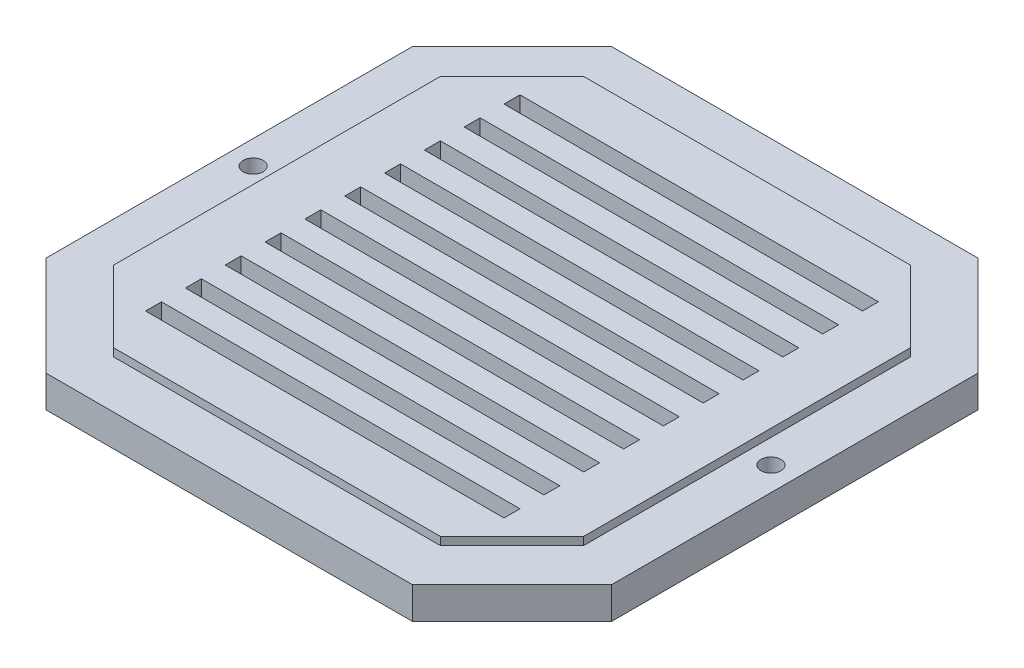
from build123d import *

# Parameters (mm, degrees)
BOSS_EXTRUDE1_DEPTH = 4
BOSS_EXTRUDE3_START = 4
BOSS_EXTRUDE3_DEPTH = 1
CUT_EXTRUDE2_REACH  = 52.364
SKETCH5_R           = 1.25
SKETCH6_R           = 2.25
CUT_EXTRUDE3_DEPTH  = 2
SKETCH7_W           = 45
SKETCH7_H           = 2
CUT_EXTRUDE4_DEPTH  = 10


with BuildPart() as part:
    # Sketch1 → Boss-Extrude1 (new body)
    with BuildSketch(Plane(origin=(0, 0, 0), x_dir=(1, 0, 0), z_dir=(0, 1, 0))):
        Polygon((-35.5, 23), (-23, 35.5), (23, 35.5), (35.5, 23), (35.5, -23), (23, -35.5), (-23, -35.5), (-35.5, -23), align=None)
    extrude(amount=BOSS_EXTRUDE1_DEPTH)

    # Sketch3 → Boss-Extrude3 (add)
    with BuildSketch(Plane(origin=(0, 0, 0), x_dir=(1, 0, 0), z_dir=(0, 1, 0)).offset(BOSS_EXTRUDE3_START)):
        Polygon((-29.5, 20.514718626), (-20.514718626, 29.5), (20.514718626, 29.5), (29.5, 20.514718626), (29.5, -20.514718626), (20.514718626, -29.5), (-20.514718626, -29.5), (-29.5, -20.514718626), align=None)
    extrude(amount=BOSS_EXTRUDE3_DEPTH)

    # Sketch5 → Cut-Extrude2 (cut, up to next)
    with BuildSketch(Plane(origin=(0, 4, 0), x_dir=(1, 0, 0), z_dir=(0, 1, 0)), mode=Mode.PRIVATE) as cut_extrude2_sk1:
        with Locations(Location((32.5, 0, 0), (0, 0, 270))):
            Circle(SKETCH5_R)
    cut_extrude2_tool1 = extrude(cut_extrude2_sk1.sketch, amount=-CUT_EXTRUDE2_REACH, mode=Mode.PRIVATE) & part.part
    # Sketch5 → Cut-Extrude2 (cut, up to next)
    with BuildSketch(Plane(origin=(0, 4, 0), x_dir=(1, 0, 0), z_dir=(0, 1, 0)), mode=Mode.PRIVATE) as cut_extrude2_sk2:
        with Locations(Location((-32.5, 0, 0), (0, 0, 270))):
            Circle(SKETCH5_R)
    cut_extrude2_tool2 = extrude(cut_extrude2_sk2.sketch, amount=-CUT_EXTRUDE2_REACH, mode=Mode.PRIVATE) & part.part
    add(cut_extrude2_tool1.solids().sort_by_distance((32.5, 4, 0))[0], mode=Mode.SUBTRACT)
    add(cut_extrude2_tool2.solids().sort_by_distance((-32.5, 4, 0))[0], mode=Mode.SUBTRACT)

    # Sketch6 → Cut-Extrude3 (cut)
    with BuildSketch(Plane.XZ):
        with Locations(Location((32.5, 0, 0), (0, 0, 270))):
            Circle(SKETCH6_R)
        with Locations(Location((-32.5, 0, 0), (0, 0, 90))):
            Circle(SKETCH6_R)
    extrude(amount=-CUT_EXTRUDE3_DEPTH, mode=Mode.SUBTRACT)

    # Sketch7 → Cut-Extrude4 (cut)
    with BuildSketch(Plane.XZ):
        with Locations((0, 22.5)):
            Rectangle(SKETCH7_W, SKETCH7_H)
        with Locations((0, 17.5)):
            Rectangle(SKETCH7_W, SKETCH7_H)
        with Locations((0, 12.5)):
            Rectangle(SKETCH7_W, SKETCH7_H)
        with Locations((0, 7.5)):
            Rectangle(SKETCH7_W, SKETCH7_H)
        with Locations((0, 2.5)):
            Rectangle(SKETCH7_W, SKETCH7_H)
        with Locations((0, -2.5)):
            Rectangle(SKETCH7_W, SKETCH7_H)
        with Locations((0, -7.5)):
            Rectangle(SKETCH7_W, SKETCH7_H)
        with Locations((0, -12.5)):
            Rectangle(SKETCH7_W, SKETCH7_H)
        with Locations((0, -17.5)):
            Rectangle(SKETCH7_W, SKETCH7_H)
        with Locations((0, -22.5)):
            Rectangle(SKETCH7_W, SKETCH7_H)
    extrude(amount=-CUT_EXTRUDE4_DEPTH, mode=Mode.SUBTRACT)


solid = part.part
